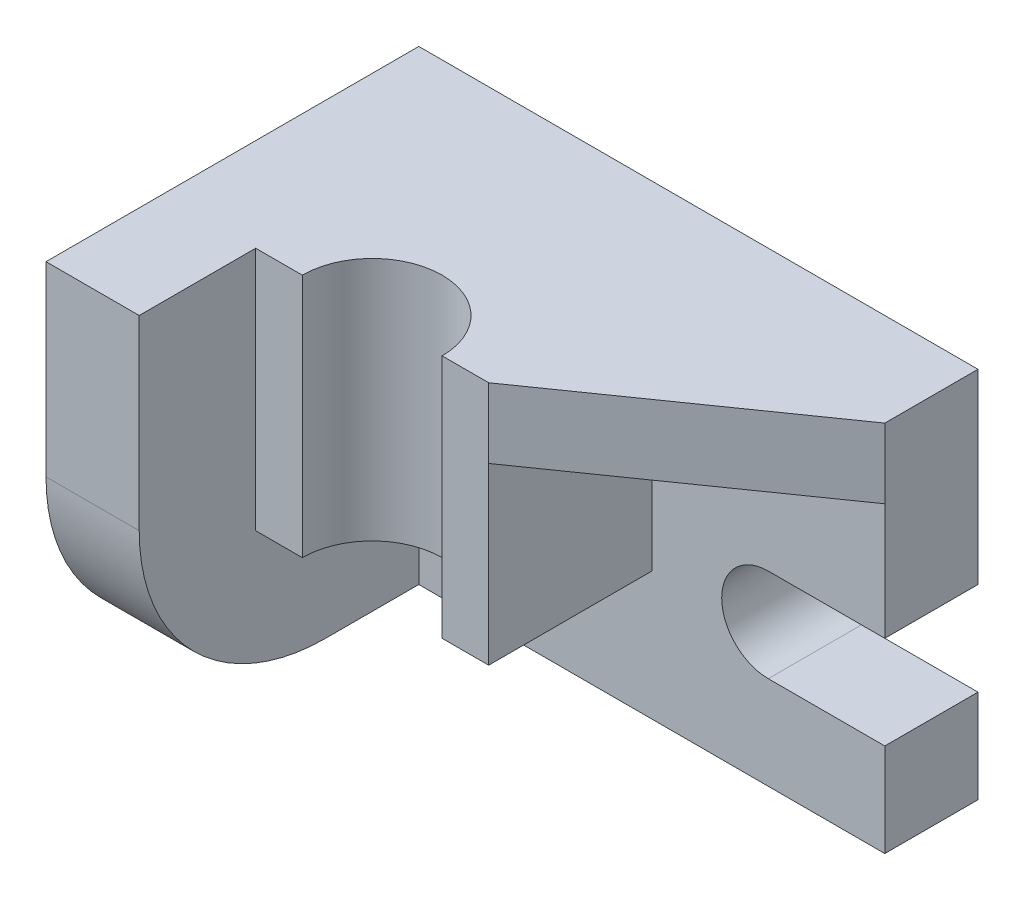
from build123d import *

# Parameters (mm, degrees)
SKETCH1_W           = 96
SKETCH1_H           = 64
BOSS_EXTRUDE1_DEPTH = 16
BOSS_EXTRUDE2_DEPTH = 16
BOSS_EXTRUDE3_DEPTH = 42
BOSS_EXTRUDE4_DEPTH = 12
CUT_EXTRUDE2_DEPTH  = 16


with BuildPart() as part:
    # Sketch1 → Boss-Extrude1 (new body)
    with BuildSketch(Plane.XY):
        with Locations((48, 32)):
            Rectangle(SKETCH1_W, SKETCH1_H)
    extrude(amount=BOSS_EXTRUDE1_DEPTH)

    # Sketch3 → Boss-Extrude2 (add)
    with BuildSketch(Plane.ZY.offset(-16)):
        with BuildLine():
            Line((16, 0), (16, 64))
            Line((16, 64), (64, 64))
            Line((64, 64), (64, 32))
            ThreePointArc((64, 32), (54.627416998, 9.372583002), (32, 0))
            Line((32, 0), (16, 0))
        make_face()
    extrude(amount=BOSS_EXTRUDE2_DEPTH)

    # Sketch4 → Boss-Extrude3 (add)
    with BuildSketch(Plane(origin=(0, 64, 0), x_dir=(1, 0, 0), z_dir=(0, 1, 0))):
        with BuildLine():
            Line((16, -16), (56, -16))
            Line((56, -16), (56, -44))
            Line((56, -44), (48, -44))
            ThreePointArc((48, -44), (36, -32), (24, -44))
            Line((24, -44), (16, -44))
            Line((16, -44), (16, -16))
        make_face()
    extrude(amount=-BOSS_EXTRUDE3_DEPTH)

    # Sketch5 → Boss-Extrude4 (add)
    with BuildSketch(Plane(origin=(0, 64, 0), x_dir=(1, 0, 0), z_dir=(0, 1, 0))):
        Polygon((96, -16), (56, -16), (56, -44), align=None)
    extrude(amount=-BOSS_EXTRUDE4_DEPTH)

    # Sketch6 → Cut-Extrude2 (cut)
    with BuildSketch(Plane.XY.offset(16)):
        with BuildLine():
            Line((96, 16), (96, 32))
            Line((96, 32), (76, 32))
            ThreePointArc((76, 32), (68, 24), (76, 16))
            Line((76, 16), (96, 16))
        make_face()
    extrude(amount=-CUT_EXTRUDE2_DEPTH, mode=Mode.SUBTRACT)


solid = part.part
